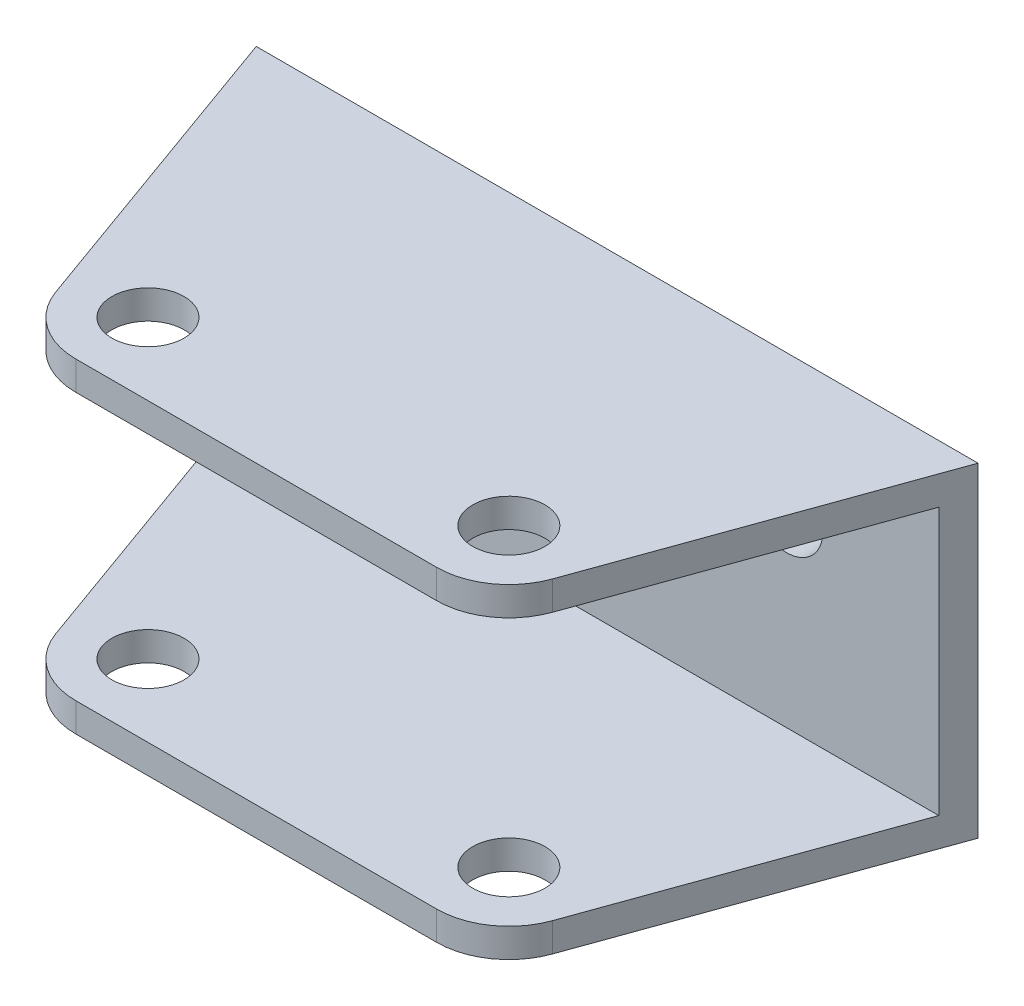
from build123d import *

# Parameters (mm, degrees)
SKETCH1_R               = 5
BOSS_EXTRUDE1_DEPTH     = 50
SKETCH2_R               = 5
CUT_EXTRUDE1_DEPTH      = 112.791815443
CUT_EXTRUDE2_DEPTH      = 177.903545314
CUT_EXTRUDE2_DEPTH_BACK = 177.903545314
SKETCH3_W               = 65.68648631
SKETCH3_H               = 37


with BuildPart() as part:
    # Sketch1 → Boss-Extrude1 (new body)
    with BuildSketch(Plane.XY.offset(32.9)):
        Polygon((-40, -144.299876296), (40, -144.299876296), (40, -99.299876296), (-40, -99.299876296), (-60, -99.299876296), (-60, -144.299876296), align=None)
        with Locations((17.5, -114.3)):
            Circle(SKETCH1_R, mode=Mode.SUBTRACT)
        with Locations((-17.5, -114.3)):
            Circle(SKETCH1_R, mode=Mode.SUBTRACT)
    extrude(amount=BOSS_EXTRUDE1_DEPTH)

    # Sketch2 → Cut-Extrude1 (cut, through all)
    with BuildSketch(Plane.XZ.offset(144.299876296)):
        with BuildLine():
            Line((-60, 82.9), (-60, 32.9))
            Line((-60, 32.9), (-44.410826478, 76.281766549))
            ThreePointArc((-44.410826478, 76.281766549), (-40.752492265, 81.07978195), (-35, 82.9))
            Line((-35, 82.9), (-60, 82.9))
        make_face()
        with BuildLine():
            Line((24.410826478, 76.281766549), (40, 32.9))
            Line((40, 32.9), (40, 82.9))
            Line((40, 82.9), (15, 82.9))
            ThreePointArc((15, 82.9), (20.752492265, 81.07978195), (24.410826478, 76.281766549))
        make_face()
        with Locations(Location((15, 72.9, 0), (0, 0, 270))):
            Circle(SKETCH2_R)
        with Locations(Location((-35, 72.9, 0), (0, 0, 270))):
            Circle(SKETCH2_R)
    extrude(amount=-CUT_EXTRUDE1_DEPTH, mode=Mode.SUBTRACT)

    # Sketch3 → Cut-Extrude2 (cut, two sides: drawn at the far end of the back side and taken through both)
    with BuildSketch(Plane(origin=(0, 0, 0), x_dir=(0, 0, -1), z_dir=(1, 0, 0)).offset(-CUT_EXTRUDE2_DEPTH_BACK)):
        with Locations((-69.743243155, -121.799876296)):
            Rectangle(SKETCH3_W, SKETCH3_H)
    extrude(amount=CUT_EXTRUDE2_DEPTH + CUT_EXTRUDE2_DEPTH_BACK, mode=Mode.SUBTRACT)


solid = part.part
